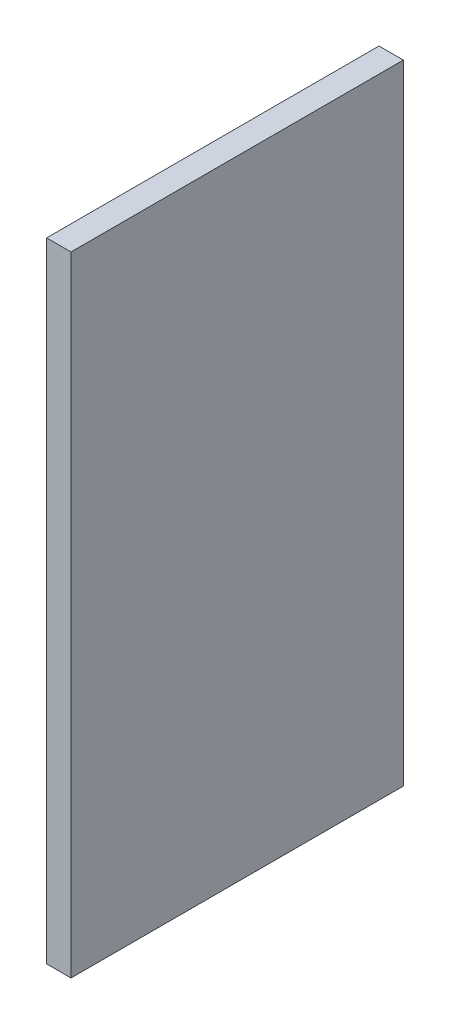
from build123d import *

# Parameters (mm, degrees)
SKETCH1_W                = 60
SKETCH1_H                = 1548.5
STORE_PU_YAN_SOL_1_DEPTH = 818.5


with BuildPart() as part:
    # Sketch1 → STORE_pu_yan_sol_1 (new body)
    with BuildSketch(Plane.XY):
        with Locations((31.5, 895.75)):
            Rectangle(SKETCH1_W, SKETCH1_H)
    extrude(amount=-STORE_PU_YAN_SOL_1_DEPTH)


solid = part.part
